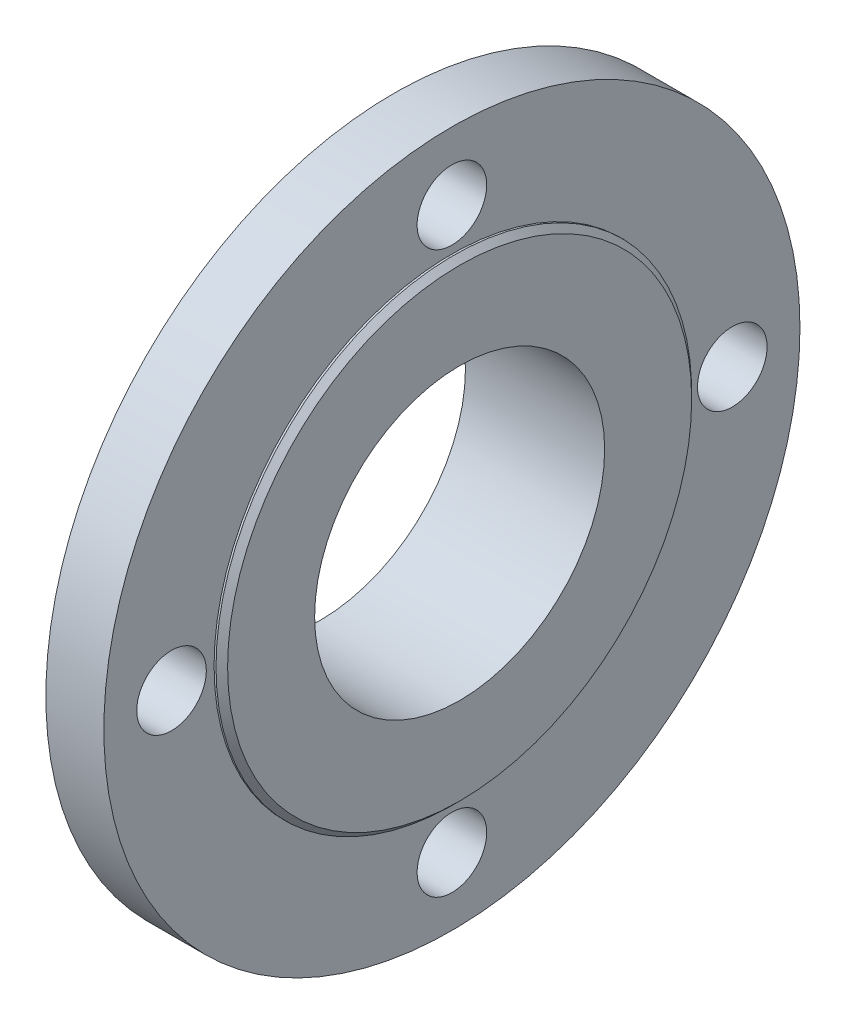
from build123d import *
from build123d.topology import SkipClean

# Parameters (mm, degrees)
SKETCH_2_R               = 9
CUT_EXTRUDE_2_DEPTH      = 132.742172443
PATTERN_CIRCULAR_2_COUNT = 4
EXTRUDE_START            = 2
SKETCH_3_R               = 61.5
SKETCH_3_R_2             = 37.5
EXTRUDE_1_DEPTH          = 2
CHAMFER_5_SIZE           = 1.5


with BuildPart() as part:
    # Эскиз1 → Повернуть1 (revolve)
    with BuildSketch(Plane.XY):
        Polygon((-34, 37.5), (0, 37.5), (0, 90), (-15, 90), (-15, 44.7), (-34, 44.7), align=None)
    revolve(axis=Axis((0, 0, 0), (-1, 0, 0)))

    # Эскиз2 → Вырез-Вытянуть2 (cut, through all)
    with BuildSketch(Plane(origin=(0, 0, 0), x_dir=(0, 0, -1), z_dir=(1, 0, 0))):
        with Locations((0, 72.5)):
            Circle(SKETCH_2_R)
    cut_extrude_2 = extrude(amount=-CUT_EXTRUDE_2_DEPTH, mode=Mode.SUBTRACT)

    # Круговой массив2: Вырез-Вытянуть2 ×4 about axis
    pattern_circular_2_axis = Axis((84.004285605, 0, 0), (-1, 0, 0))
    for i in range(1, PATTERN_CIRCULAR_2_COUNT):
        add(cut_extrude_2.rotate(pattern_circular_2_axis, i * 360 / PATTERN_CIRCULAR_2_COUNT), mode=Mode.SUBTRACT)

    # Эскиз3 → Вытянуть1 (add)
    with SkipClean():  # the faces are left unmerged after this step: merging them gives an invalid solid
        with BuildSketch(Plane(origin=(0, 0, 0), x_dir=(0, 0, -1), z_dir=(1, 0, 0)).offset(EXTRUDE_START)):
            Circle(SKETCH_3_R)
            Circle(SKETCH_3_R_2, mode=Mode.SUBTRACT)
        extrude(amount=-EXTRUDE_1_DEPTH)

    # Фаска5
    chamfer_5_edges = [part.edges().sort_by_distance(p)[0] for p in [
        (2, 0, 61.5),
    ]]
    chamfer(chamfer_5_edges, length=CHAMFER_5_SIZE)


solid = part.part
